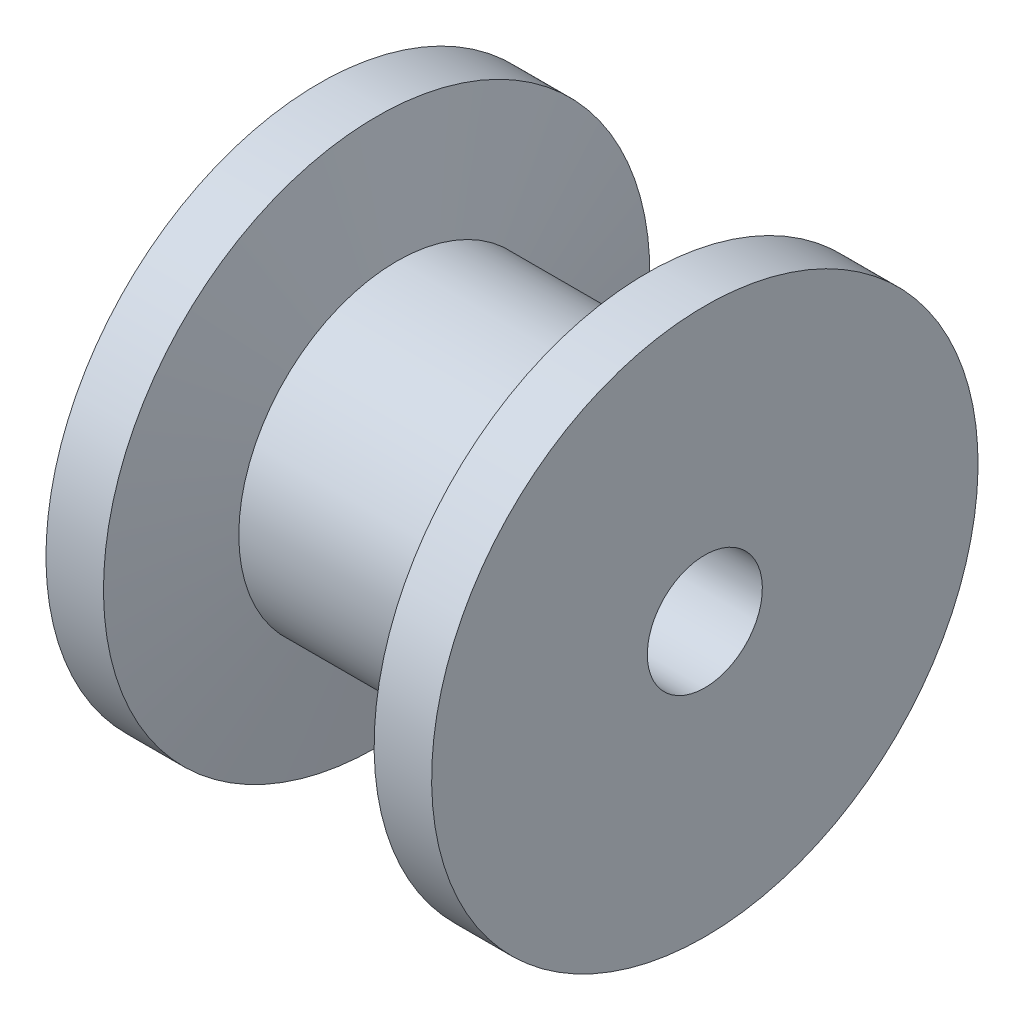
from build123d import *


with BuildPart() as part:
    # Sketch1 → Revolve1 (revolve)
    with BuildSketch(Plane.XY, mode=Mode.PRIVATE) as revolve1_sk:
        Polygon((-21.420911633, 2), (-21.420911633, 9.5), (-23.420911633, 9.5), (-24.126219556, 5.5), (-32.126219556, 5.5), (-32.831527478, 9.5), (-34.831527478, 9.5), (-34.831527478, 3), (-34.831527478, 0), (-33.420911633, 0), (-33.420911633, 2), align=None)
    revolve(revolve1_sk.sketch.rotate(Axis((-34.831527478, 0, 0), (1, 0, 0)), 180), axis=Axis((-34.831527478, 0, 0), (1, 0, 0)))


solid = part.part
